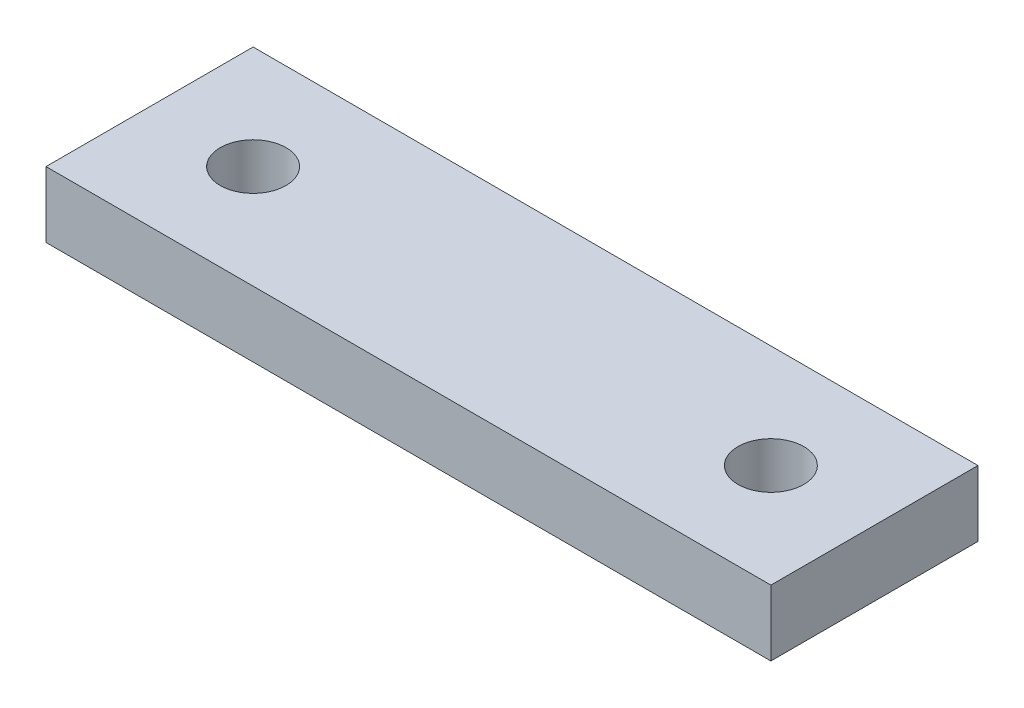
from build123d import *

# Parameters (mm, degrees)
SKETCH1_W           = 70
SKETCH1_H           = 20
BOSS_EXTRUDE1_DEPTH = 6.35
SKETCH2_R           = 3.175
CUT_EXTRUDE1_DEPTH  = 6.35


with BuildPart() as part:
    # Sketch1 → Boss-Extrude1 (new body)
    with BuildSketch(Plane(origin=(0, 0, 0), x_dir=(1, 0, 0), z_dir=(0, 1, 0))):
        Rectangle(SKETCH1_W, SKETCH1_H)
    extrude(amount=BOSS_EXTRUDE1_DEPTH)

    # Sketch2 → Cut-Extrude1 (cut)
    with BuildSketch(Plane(origin=(0, 6.35, 0), x_dir=(1, 0, 0), z_dir=(0, 1, 0))):
        with Locations(Location((-25, 0, 0), (0, 0, 270))):
            Circle(SKETCH2_R)
        with Locations(Location((25, 0, 0), (0, 0, 270))):
            Circle(SKETCH2_R)
    extrude(amount=-CUT_EXTRUDE1_DEPTH, mode=Mode.SUBTRACT)


solid = part.part
